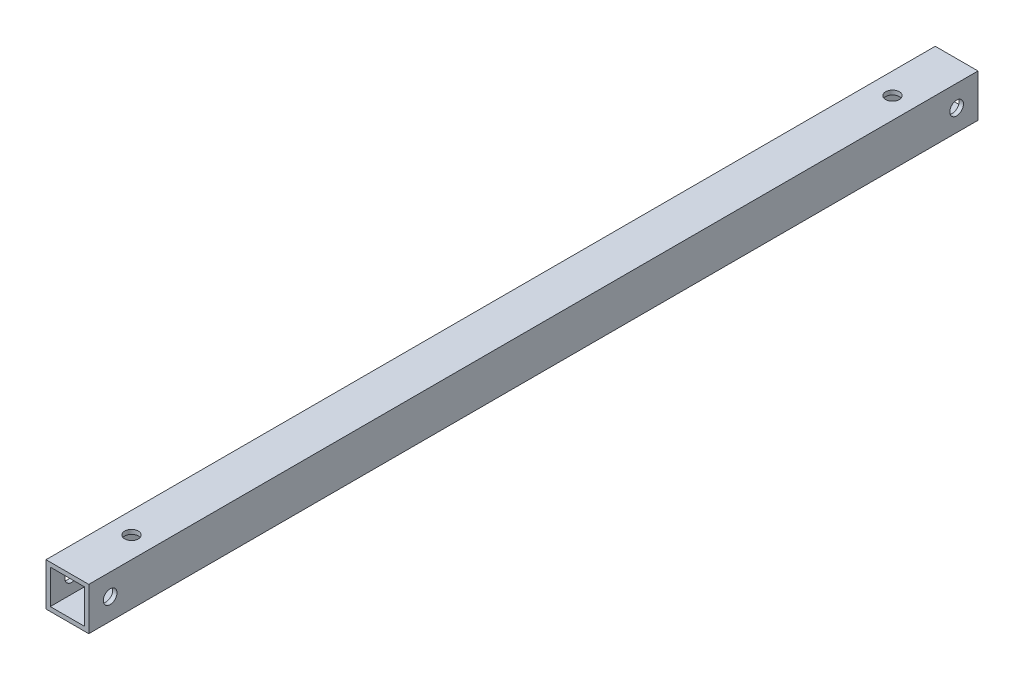
from build123d import *

# Parameters (mm, degrees)
SKETCH_1_W          = 10
SKETCH_1_H          = 10
SKETCH_1_W_2        = 8
SKETCH_1_H_2        = 8
EXTRUDE_1_DEPTH     = 208
SKETCH_2_R          = 1.6
CUT_EXTRUDE_1_DEPTH = 209.300264042
SKETCH_3_R          = 1.6
CUT_EXTRUDE_2_DEPTH = 209.300264042


with BuildPart() as part:
    # ｽｹｯﾁ1 → ﾎﾞｽ - 押し出し1 (new body)
    with BuildSketch(Plane.XY):
        Rectangle(SKETCH_1_W, SKETCH_1_H)
        Rectangle(SKETCH_1_W_2, SKETCH_1_H_2, mode=Mode.SUBTRACT)
    extrude(amount=EXTRUDE_1_DEPTH)

    # ｽｹｯﾁ2 → ｶｯﾄ - 押し出し1 (cut, through all)
    with BuildSketch(Plane(origin=(0, 5, 0), x_dir=(1, 0, 0), z_dir=(0, 1, 0))):
        with Locations(Location((0, -193, 0), (0, 0, 270))):
            Circle(SKETCH_2_R)
        with Locations(Location((0, -15, 0), (0, 0, 270))):
            Circle(SKETCH_2_R)
    extrude(amount=-CUT_EXTRUDE_1_DEPTH, mode=Mode.SUBTRACT)

    # ｽｹｯﾁ3 → ｶｯﾄ - 押し出し2 (cut, through all)
    with BuildSketch(Plane.ZY.offset(5)):
        with Locations(Location((203, 0, 0), (0, 0, 270))):
            Circle(SKETCH_3_R)
        with Locations(Location((5, 0, 0), (0, 0, 270))):
            Circle(SKETCH_3_R)
    extrude(amount=-CUT_EXTRUDE_2_DEPTH, mode=Mode.SUBTRACT)


solid = part.part
